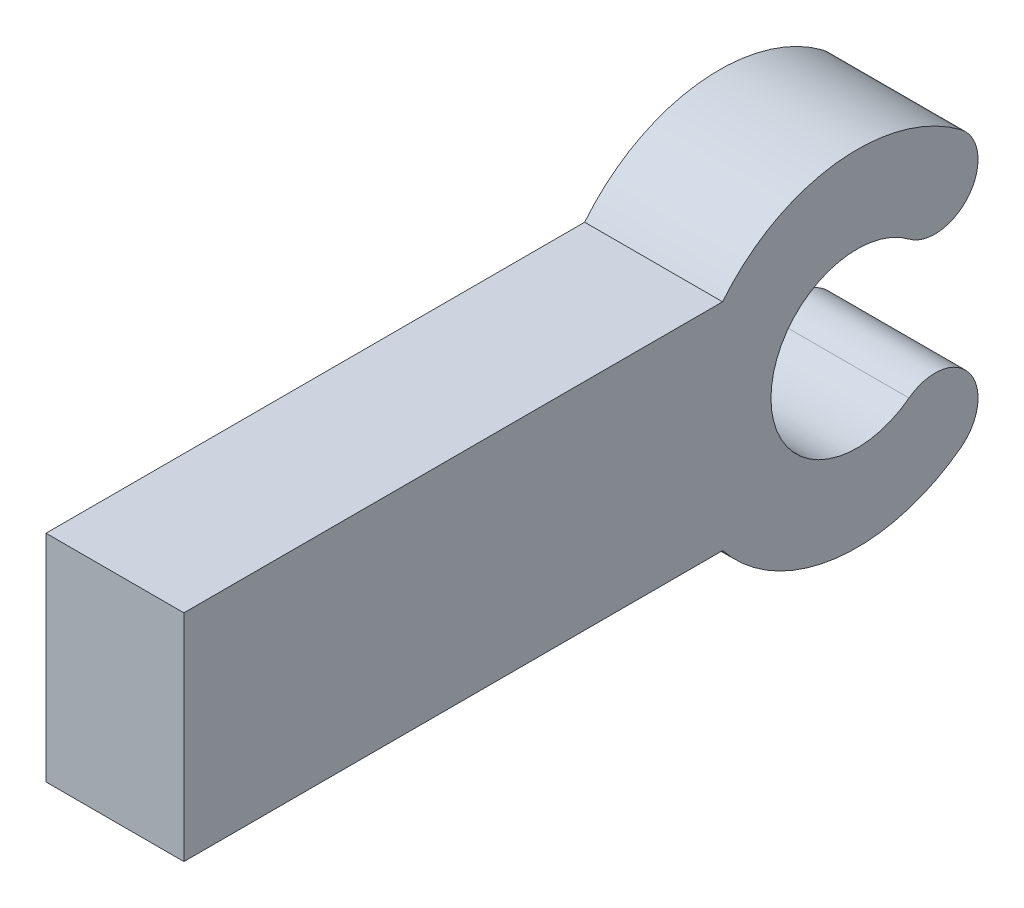
from build123d import *

# Parameters (mm, degrees)
BOSS_EXTRUDE1_DEPTH = 1.6256


with BuildPart() as part:
    # Sketch1 → Boss-Extrude1 (new body)
    with BuildSketch(Plane(origin=(0, 0, 0), x_dir=(0, 0, -1), z_dir=(1, 0, 0))):
        with BuildLine():
            Line((0, 0), (6.35, 0))
            ThreePointArc((6.35, 0), (7.682998327, -0.746159214), (9.159117619, -0.352827356))
            ThreePointArc((9.159117619, -0.352827356), (9.259102426, 0.358601514), (8.547673555, 0.458586322))
            ThreePointArc((8.547673555, 0.458586322), (6.920229492, 1.27), (8.547673555, 2.081413678))
            ThreePointArc((8.547673555, 2.081413678), (9.259102426, 2.181398486), (9.159117619, 2.892827356))
            ThreePointArc((9.159117619, 2.892827356), (7.682998327, 3.286159214), (6.35, 2.54))
            Line((6.35, 2.54), (0, 2.54))
            Line((0, 2.54), (0, 0))
        make_face()
    extrude(amount=BOSS_EXTRUDE1_DEPTH)


solid = part.part
